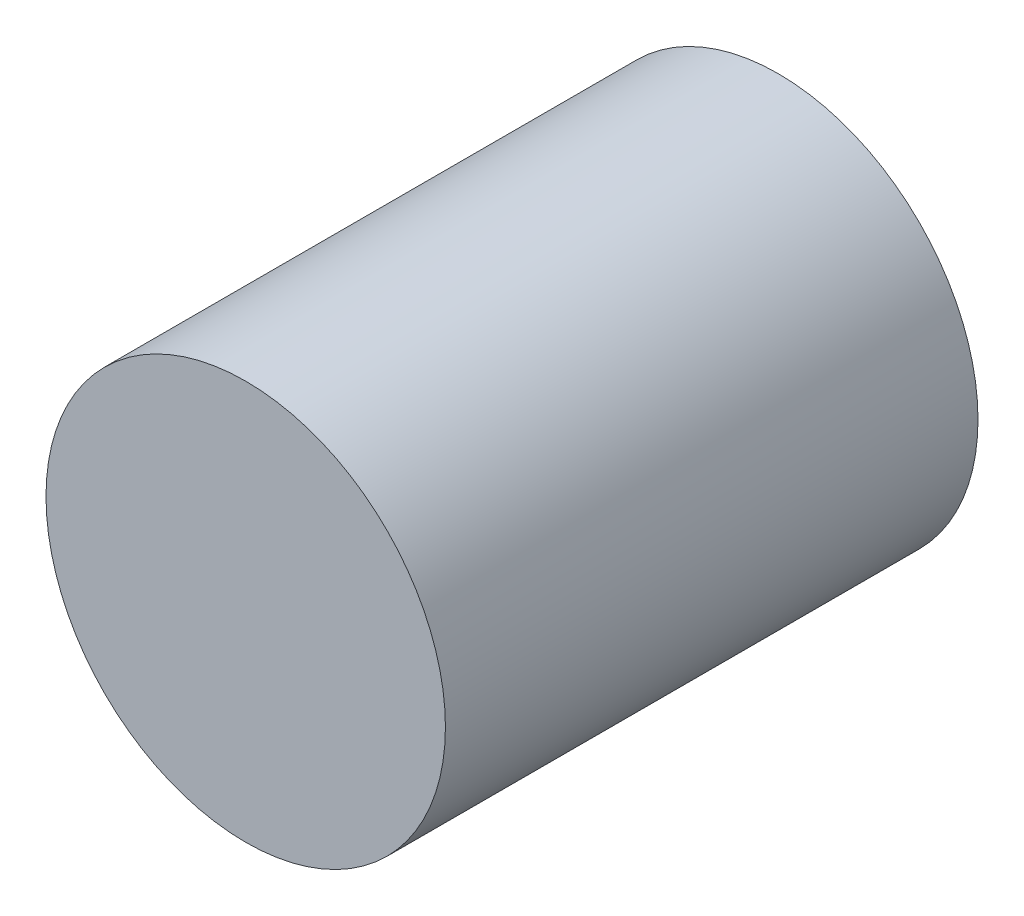
from build123d import *

# Parameters (mm, degrees)
SKETCH1_R           = 22.5
BOSS_EXTRUDE1_DEPTH = 30


with BuildPart() as part:
    # Sketch1 → Boss-Extrude1 (new, symmetric)
    with BuildSketch(Plane.XY):
        Circle(SKETCH1_R)
    extrude(amount=BOSS_EXTRUDE1_DEPTH, both=True)


solid = part.part
